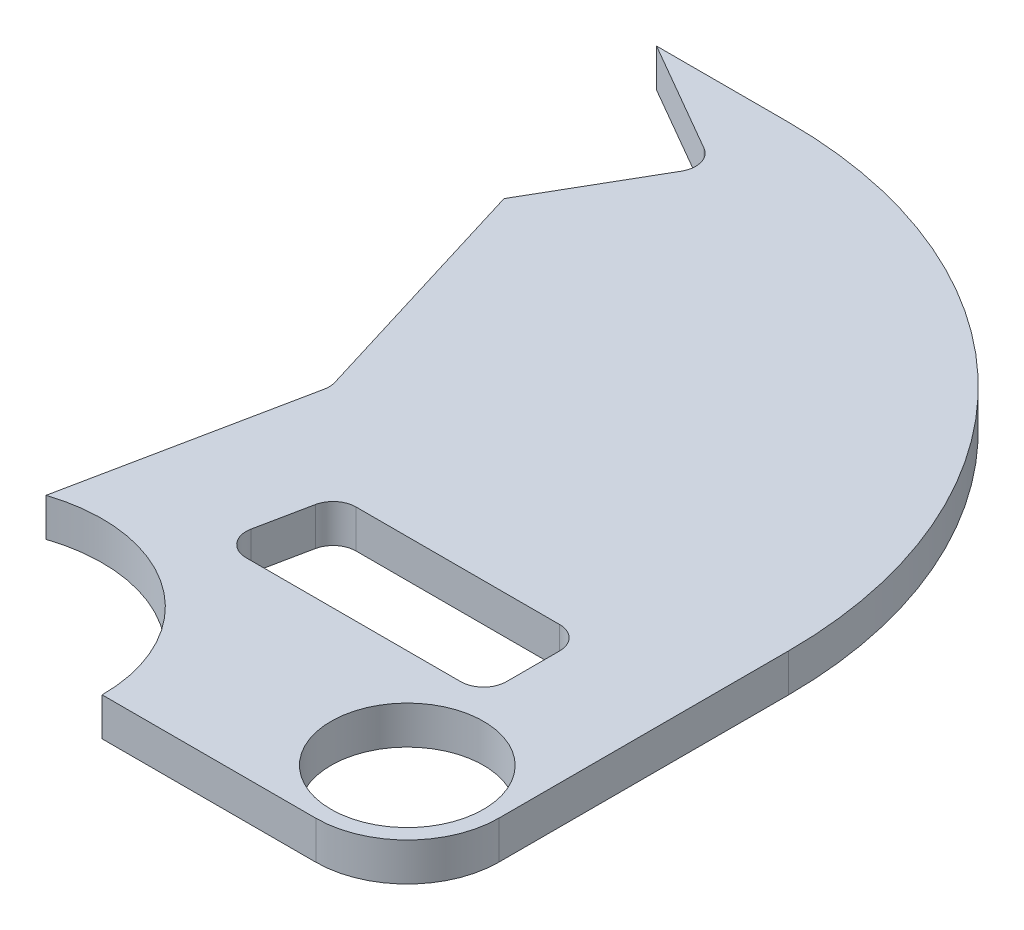
from build123d import *

# Parameters (mm, degrees)
PROFILE_SKETCH_R      = 10
PROFILE_EXTRUDE_DEPTH = 5
TRAPEZOID_FILLET_R    = 3
CLAW_FILLET_R         = 3


with BuildPart() as part:
    # Profile Sketch → Profile Extrude (new body)
    with BuildSketch(Plane(origin=(0, 0, 0), x_dir=(1, 0, 0), z_dir=(0, 1, 0))):
        with BuildLine():
            Line((0, 60), (-17.320508076, 60))
            Line((-17.320508076, 60), (0, 50))
            Line((0, 50), (-10, 32.679491924))
            Line((-10, 32.679491924), (0, 0))
            Line((0, 0), (-6.333857356, -31.029437252))
            ThreePointArc((-6.333857356, -31.029437252), (11.690227818, -33.772289947), (20, -50))
            Line((20, -50), (48, -50))
            ThreePointArc((48, -50), (56.485281374, -46.485281374), (60, -38))
            Line((60, -38), (60, 0))
            ThreePointArc((60, 0), (42.426406871, 42.426406871), (0, 60))
        make_face()
        with Locations(Location((48, -38, 0), (0, 0, 270))):
            Circle(PROFILE_SKETCH_R, mode=Mode.SUBTRACT)
        Polygon((12.853812296, -12.029437252), (45, -12.029437252), (45, -25), (10.206207262, -25), align=None, mode=Mode.SUBTRACT)
    extrude(amount=PROFILE_EXTRUDE_DEPTH)

    # Trapezoid Fillet
    trapezoid_fillet_edges = [part.edges().sort_by_distance(p)[0] for p in [
        (10.206207262, 2.5, 25),
        (45, 2.5, 25),
        (45, 2.5, 12.029437252),
        (12.853812296, 2.5, 12.029437252),
    ]]
    fillet(trapezoid_fillet_edges, radius=TRAPEZOID_FILLET_R)

    # Claw Fillet
    claw_fillet_edges = [part.edges().sort_by_distance(p)[0] for p in [
        (0, 2.5, -50),
        (0, 2.5, 0),
    ]]
    fillet(claw_fillet_edges, radius=CLAW_FILLET_R)


solid = part.part
